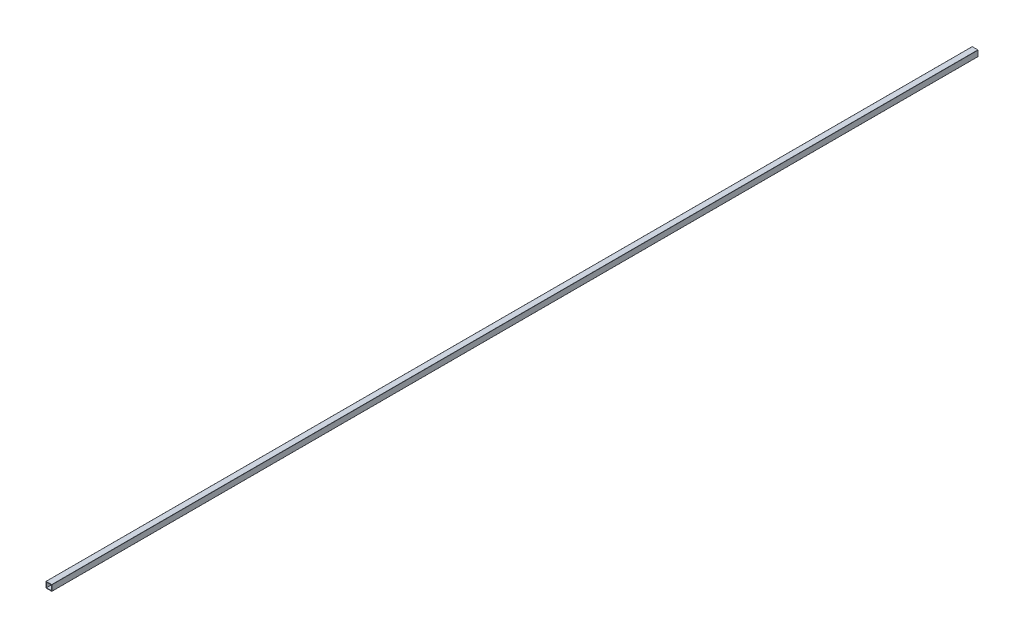
from build123d import *

# Parameters (mm, degrees)
CROQUIS1_W              = 32.02
CROQUIS1_H              = 32.02
SALIENTE_EXTRUIR1_DEPTH = 6000


with BuildPart() as part:
    # Croquis1 → Saliente-Extruir1 (new body)
    with BuildSketch(Plane.XY):
        with BuildLine():
            Line((-18.05, -19.05), (18.05, -19.05))
            ThreePointArc((18.05, -19.05), (18.757106781, -18.757106781), (19.05, -18.05))
            Line((19.05, -18.05), (19.05, 18.05))
            ThreePointArc((19.05, 18.05), (18.757106781, 18.757106781), (18.05, 19.05))
            Line((18.05, 19.05), (-18.05, 19.05))
            ThreePointArc((-18.05, 19.05), (-18.757106781, 18.757106781), (-19.05, 18.05))
            Line((-19.05, 18.05), (-19.05, -18.05))
            ThreePointArc((-19.05, -18.05), (-18.757106781, -18.757106781), (-18.05, -19.05))
        make_face()
        Rectangle(CROQUIS1_W, CROQUIS1_H, mode=Mode.SUBTRACT)
    extrude(amount=SALIENTE_EXTRUIR1_DEPTH)


solid = part.part
